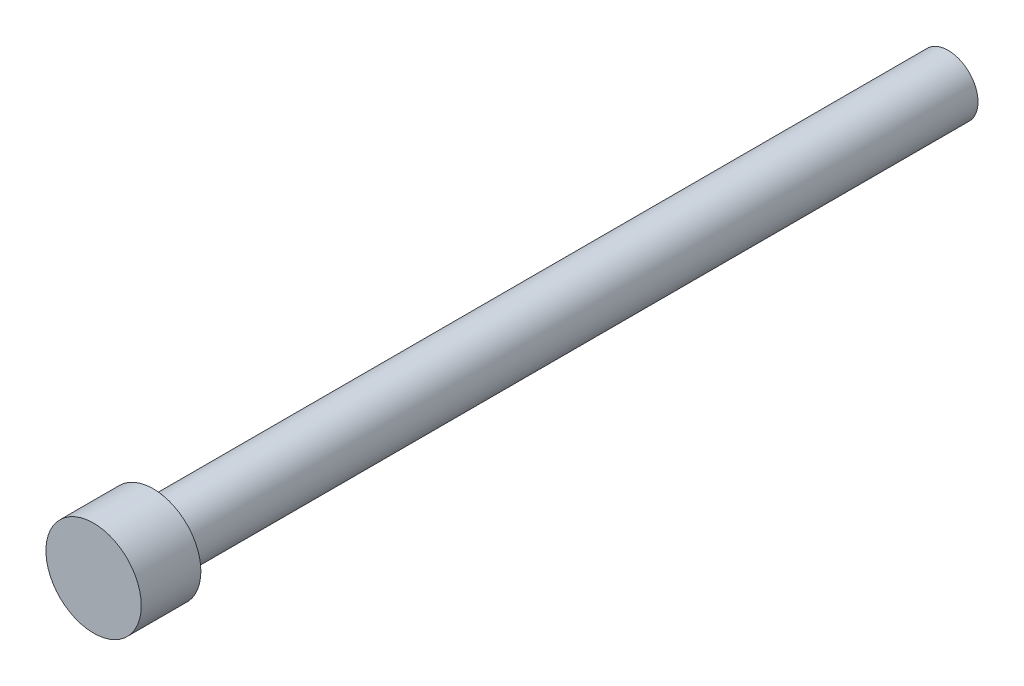
from build123d import *

# Parameters (mm, degrees)
SKETCH1_R      = 3.175
EXTRUDE1_DEPTH = 84.709
SKETCH2_R      = 5.08
EXTRUDE2_DEPTH = 6.35


with BuildPart() as part:
    # Sketch1 → Extrude1 (new body)
    with BuildSketch(Plane.XY):
        with Locations((-81.443110483, -68.468113052)):
            Circle(SKETCH1_R)
    extrude(amount=-EXTRUDE1_DEPTH)

    # Sketch2 → Extrude2 (add)
    with BuildSketch(Plane.XY):
        with Locations((-81.443110483, -68.468113052)):
            Circle(SKETCH2_R)
    extrude(amount=EXTRUDE2_DEPTH)


solid = part.part
